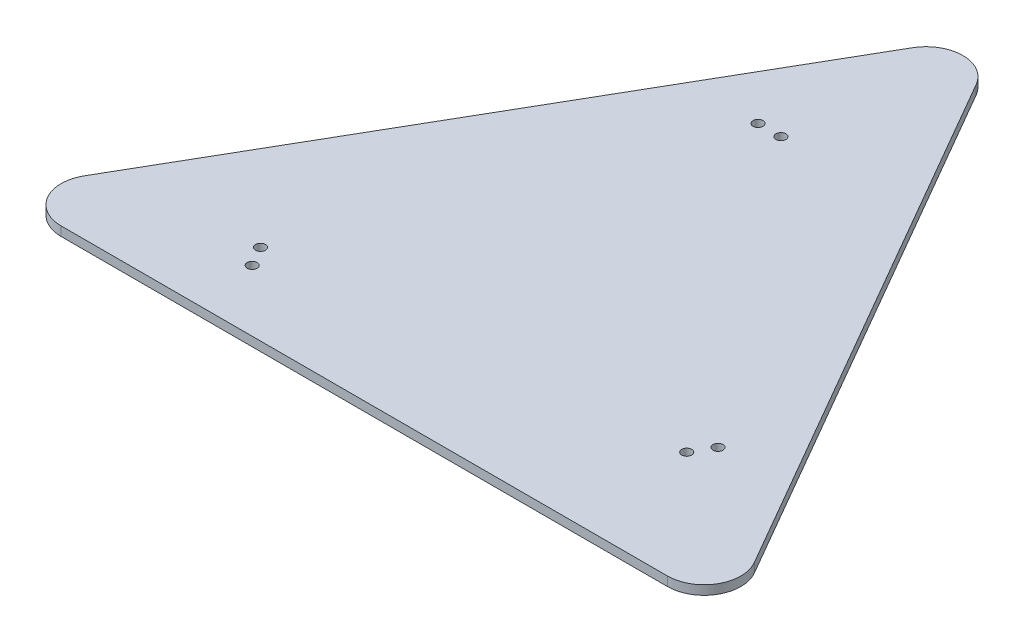
from build123d import *

# Parameters (mm, degrees)
BOSS_EXTRUDE1_DEPTH = 3.175
SKETCH2_R           = 1.7272
CUT_EXTRUDE1_DEPTH  = 195.021684248
FILLET1_R           = 12.7


with BuildPart() as part:
    # Sketch1 → Boss-Extrude1 (new body)
    with BuildSketch(Plane(origin=(0, 0, 0), x_dir=(1, 0, 0), z_dir=(0, 1, 0))):
        Polygon((0, 146.646968374), (-127, -73.323484187), (127, -73.323484187), align=None)
    extrude(amount=BOSS_EXTRUDE1_DEPTH)

    # Sketch2 → Cut-Extrude1 (cut, through all)
    with BuildSketch(Plane(origin=(0, 3.175, 0), x_dir=(1, 0, 0), z_dir=(0, 1, 0))):
        with Locations((71.193145986, -32.861822377)):
            Circle(SKETCH2_R)
        with Locations((75.155545986, -25.998744257)):
            Circle(SKETCH2_R)
        with Locations((-64.055745986, -45.224161811)):
            Circle(SKETCH2_R)
        with Locations((-60.093345986, -52.08723993)):
            Circle(SKETCH2_R)
        with Locations((-7.1374, 78.085984187)):
            Circle(SKETCH2_R)
        with Locations((-15.0622, 78.085984187)):
            Circle(SKETCH2_R)
    extrude(amount=-CUT_EXTRUDE1_DEPTH, mode=Mode.SUBTRACT)

    # Fillet1
    fillet1_edges = [part.edges().sort_by_distance(p)[0] for p in [
        (127, 1.5875, 73.323484187),
        (-127, 1.5875, 73.323484187),
        (0, 1.5875, -146.646968374),
    ]]
    fillet(fillet1_edges, radius=FILLET1_R)


solid = part.part
